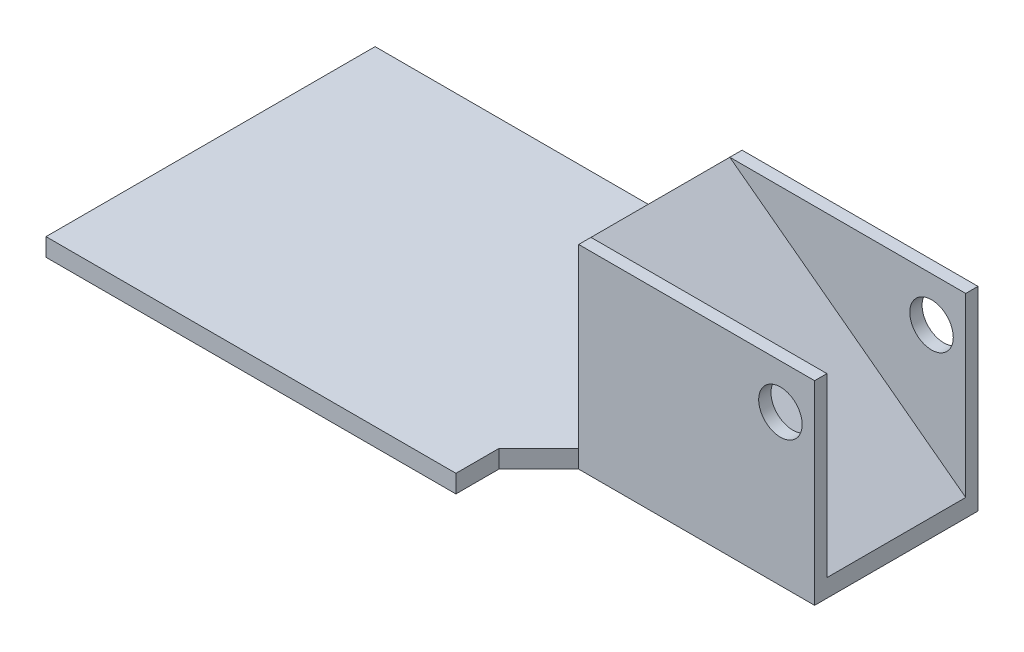
from build123d import *

# Parameters (mm, degrees)
BOSS_EXTRUDE6_DEPTH  = 2.05994
SKETCH9_W            = 27.13228
SKETCH9_H            = 1.41224
BOSS_EXTRUDE7_DEPTH  = 20.32
SKETCH10_R           = 2.50063
CUT_EXTRUDE3_DEPTH   = 25.4
BOSS_EXTRUDE10_DEPTH = 16.02994


with BuildPart() as part:
    # Sketch8 → Boss-Extrude6 (new body)
    with BuildSketch(Plane(origin=(0, 0, 0), x_dir=(1, 0, 0), z_dir=(0, 1, 0))):
        Polygon((-44.974060072, -2.900891689), (-44.974060072, -40.746891689), (2.165799928, -40.746891689), (2.165799928, -35.808024144), (6.755579928, -31.218244144), (33.887859928, -31.218244144), (33.887859928, -12.429539234), (6.755579928, -12.429539234), (2.165799928, -7.839759234), (2.165799928, -2.900891689), align=None)
    extrude(amount=BOSS_EXTRUDE6_DEPTH)

    # Sketch9 → Boss-Extrude7 (add)
    with BuildSketch(Plane(origin=(0, 2.05994, 0), x_dir=(1, 0, 0), z_dir=(0, 1, 0))):
        with Locations((20.321719928, -13.135659234)):
            Rectangle(SKETCH9_W, SKETCH9_H)
        with Locations((20.321719928, -30.512124144)):
            Rectangle(SKETCH9_W, SKETCH9_H)
    extrude(amount=BOSS_EXTRUDE7_DEPTH)

    # Sketch10 → Cut-Extrude3 (cut)
    with BuildSketch(Plane.XY.offset(31.218244144)):
        with Locations((29.955939928, 17.2847)):
            Circle(SKETCH10_R)
    extrude(amount=-CUT_EXTRUDE3_DEPTH, mode=Mode.SUBTRACT)

    # Sketch14 → Boss-Extrude10 (add)
    with BuildSketch(Plane.XY.offset(13.841779234)):
        Polygon((6.755579928, 22.37994), (33.887859928, 2.05994), (30.568919609, 2.05994), (6.755579928, 19.826826768), align=None)
    extrude(amount=BOSS_EXTRUDE10_DEPTH)


solid = part.part
